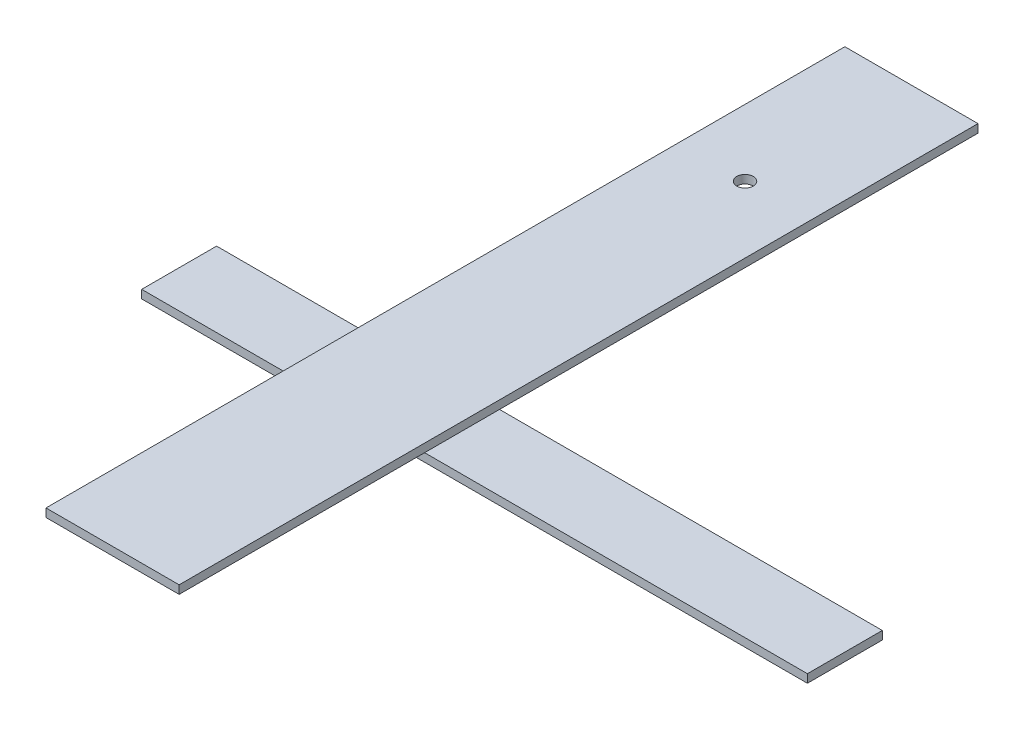
from build123d import *

# Parameters (mm, degrees)
SKETCH1_W           = 57.15
SKETCH1_H           = 6.35
BOSS_EXTRUDE1_DEPTH = 254
SKETCH2_W           = 101.6
SKETCH2_H           = 6.35
BOSS_EXTRUDE2_DEPTH = 304.8
SKETCH3_R           = 6.35
CUT_EXTRUDE1_DEPTH  = 6.35


with BuildPart() as part:
    # Sketch1 → Boss-Extrude1 (new, symmetric)
    with BuildSketch(Plane(origin=(0, 0, 0), x_dir=(0, 0, -1), z_dir=(1, 0, 0))):
        with Locations((0, 3.175)):
            Rectangle(SKETCH1_W, SKETCH1_H)
    extrude(amount=BOSS_EXTRUDE1_DEPTH, both=True)


with BuildPart() as body_2:
    # Sketch2 → Boss-Extrude2 (new, symmetric)
    with BuildSketch(Plane.XY):
        with Locations((0, 98.425)):
            Rectangle(SKETCH2_W, SKETCH2_H)
    extrude(amount=BOSS_EXTRUDE2_DEPTH, both=True)

    # Sketch3 → Cut-Extrude1 (cut)
    with BuildSketch(Plane(origin=(0, 101.6, 0), x_dir=(1, 0, 0), z_dir=(0, 1, 0))):
        with Locations(Location((0, 177.8, 0), (0, 0, 270))):
            Circle(SKETCH3_R)
    extrude(amount=-CUT_EXTRUDE1_DEPTH, mode=Mode.SUBTRACT)


solid = Compound([part.part, body_2.part])
